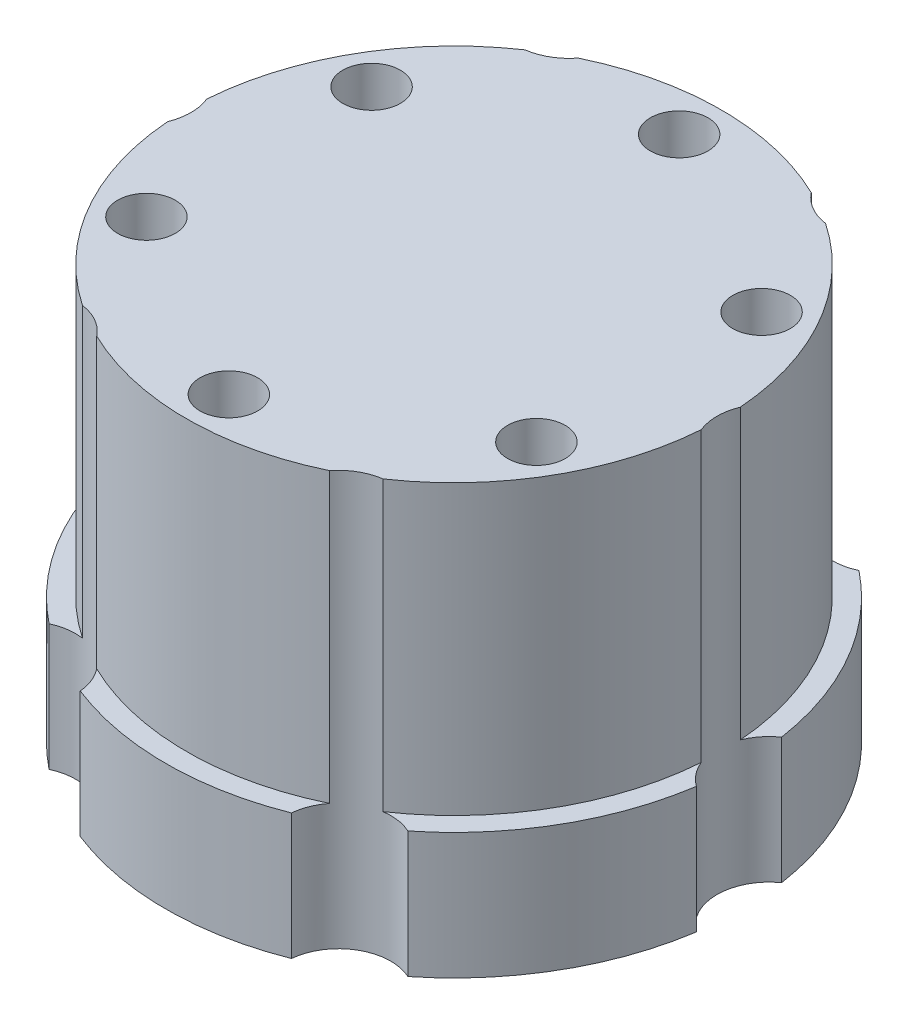
from build123d import *

# Parameters (mm, degrees)
SKETCH_1_R          = 16
EXTRUDE_1_DEPTH     = 7
SKETCH_2_R          = 14.85
EXTRUDE_2_DEPTH     = 16
SKETCH_3_R          = 1.6
CUT_EXTRUDE_1_DEPTH = 33.26453161
SKETCH_4_R          = 2.9
CUT_EXTRUDE_2_DEPTH = 33.26453161


with BuildPart() as part:
    # 草图1 → 凸台-拉伸1 (new body)
    with BuildSketch(Plane(origin=(0, 0, 0), x_dir=(1, 0, 0), z_dir=(0, 1, 0))):
        with Locations(Location((0, 0, 0), (0, 0, 270))):
            Circle(SKETCH_1_R)
    extrude(amount=EXTRUDE_1_DEPTH)

    # 草图2 → 凸台-拉伸2 (add)
    with BuildSketch(Plane(origin=(0, 7, 0), x_dir=(1, 0, 0), z_dir=(0, 1, 0))):
        with Locations(Location((0, 0, 0), (0, 0, 270))):
            Circle(SKETCH_2_R)
    extrude(amount=EXTRUDE_2_DEPTH)

    # 草图3 → 切除-拉伸1 (cut, through all)
    with BuildSketch(Plane(origin=(0, 23, 0), x_dir=(1, 0, 0), z_dir=(0, 1, 0))):
        with Locations(Location((0, 12.5, 0), (0, 0, 270))):
            Circle(SKETCH_3_R)
        with Locations(Location((10.825317547, 6.25, 0), (0, 0, 270))):
            Circle(SKETCH_3_R)
        with Locations(Location((10.825317547, -6.25, 0), (0, 0, 270))):
            Circle(SKETCH_3_R)
        with Locations(Location((0, -12.5, 0), (0, 0, 270))):
            Circle(SKETCH_3_R)
        with Locations(Location((-10.825317547, -6.25, 0), (0, 0, 270))):
            Circle(SKETCH_3_R)
        with Locations(Location((-10.825317547, 6.25, 0), (0, 0, 270))):
            Circle(SKETCH_3_R)
    extrude(amount=-CUT_EXTRUDE_1_DEPTH, mode=Mode.SUBTRACT)

    # 草图4 → 切除-拉伸2 (cut, through all)
    with BuildSketch(Plane.XZ):
        with Locations((8.75, 15.155444566)):
            Circle(SKETCH_4_R)
        with Locations((17.5, 0)):
            Circle(SKETCH_4_R)
        with Locations((8.75, -15.155444566)):
            Circle(SKETCH_4_R)
        with Locations((-8.75, -15.155444566)):
            Circle(SKETCH_4_R)
        with Locations((-17.5, 0)):
            Circle(SKETCH_4_R)
        with Locations((-8.75, 15.155444566)):
            Circle(SKETCH_4_R)
    extrude(amount=-CUT_EXTRUDE_2_DEPTH, mode=Mode.SUBTRACT)


solid = part.part
